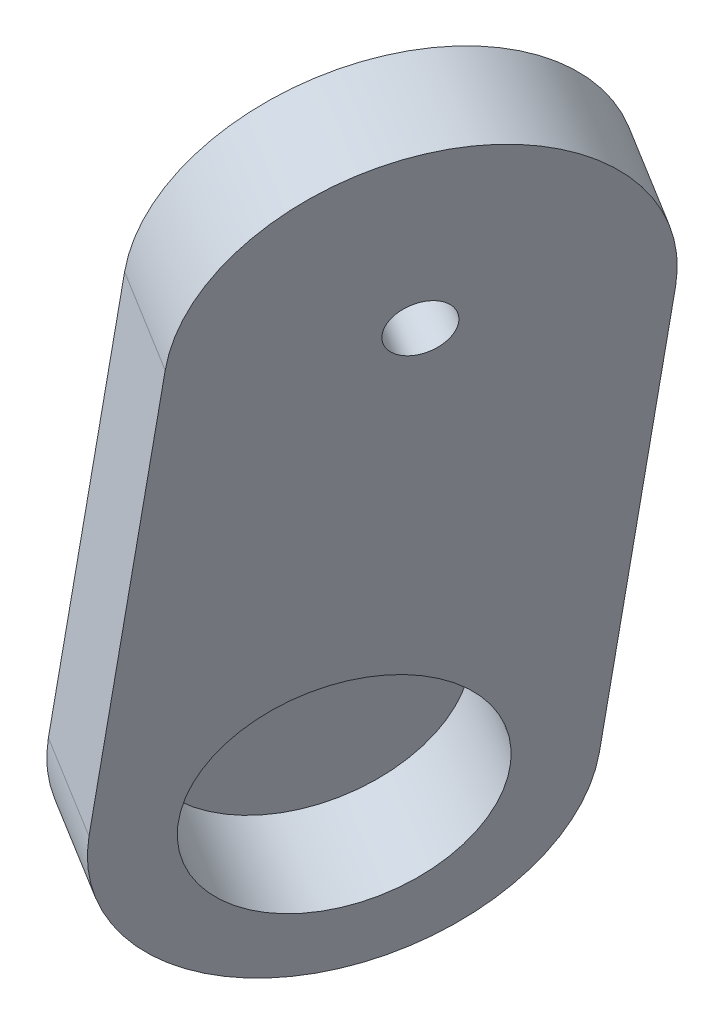
from build123d import *

# Parameters (mm, degrees)
SKETCH_1_R      = 1.5
SKETCH_1_R_2    = 6.5
EXTRUDE_1_DEPTH = 5
SKETCH_3_R      = 8
EXTRUDE_2_DEPTH = 2


with BuildPart() as part:
    # Эскиз1 → Бобышка-Вытянуть1 (new body)
    with BuildSketch(Plane(origin=(-480.803789864, 134.652080906, -243.886731474), x_dir=(0.4444744759103933, -0.03421577425644369, -0.8951378223805614), z_dir=(0.865247481188387, -0.24231791906874578, 0.4388950015611307))):
        with BuildLine():
            Line((-688.122906945, -142.837632594), (-688.122906945, -168.837632594))
            ThreePointArc((-688.122906945, -168.837632594), (-678.122906945, -178.837632594), (-668.122906945, -168.837632594))
            Line((-668.122906945, -168.837632594), (-668.122906945, -142.837632594))
            ThreePointArc((-668.122906945, -142.837632594), (-678.122906945, -132.837632594), (-688.122906945, -142.837632594))
        make_face()
        with Locations(Location((-678.122906945, -142.837632594, 0), (0, 0, 2.021059913))):
            Circle(SKETCH_1_R, mode=Mode.SUBTRACT)
        with Locations(Location((-678.122906945, -168.837632594, 0), (0, 0, 2.021059913))):
            Circle(SKETCH_1_R_2, mode=Mode.SUBTRACT)
    extrude(amount=EXTRUDE_1_DEPTH)

    # Эскиз3 → Бобышка-Вытянуть2 (add)
    with BuildSketch(Plane(origin=(-480.803789864, 134.652080906, -243.886731474), x_dir=(0.10581409215127123, 0.9439807153609489, 0.31257604983241044), z_dir=(-0.865247481188387, 0.24231791906874575, -0.4388950015611306))):
        with Locations(Location((16.948979253, -698.619750083, 0), (0, 0, 103.349815393))):
            Circle(SKETCH_3_R)
    extrude(amount=EXTRUDE_2_DEPTH)


solid = part.part
